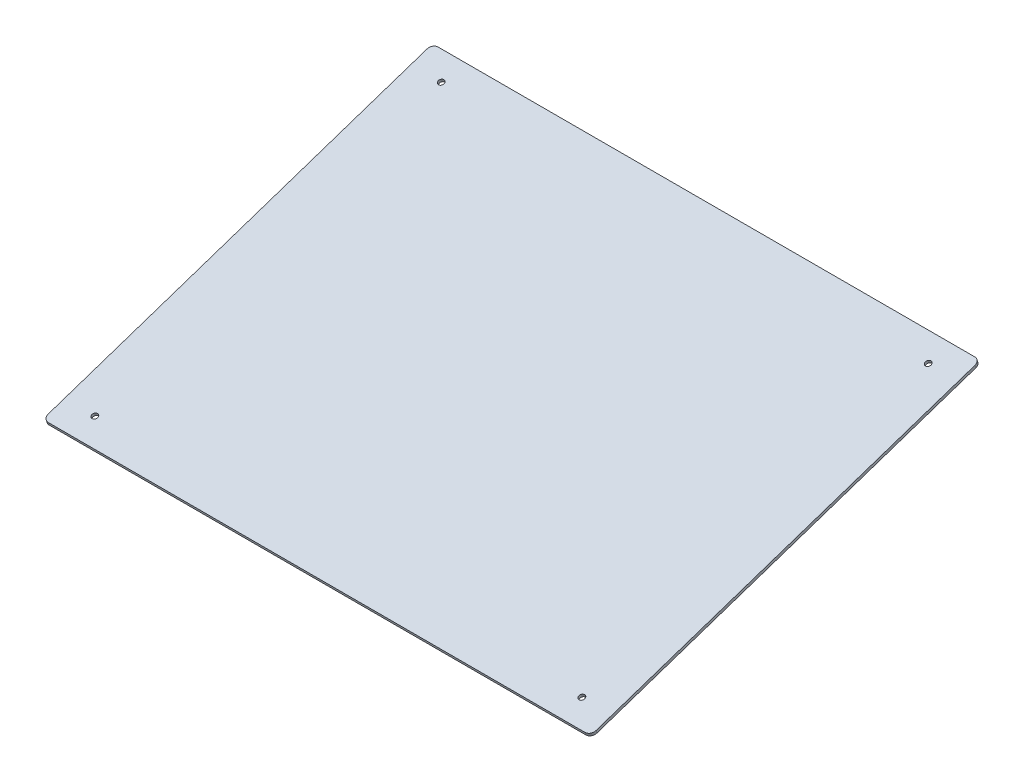
from build123d import *

# Parameters (mm, degrees)
SKETCH3_W           = 457.2
SKETCH3_H           = 609.6
SKETCH3_R           = 3.175
BOSS_EXTRUDE1_DEPTH = 3.175
FILLET1_R           = 6.35


with BuildPart() as part:
    # Sketch3 → Boss-Extrude1 (new body)
    with BuildSketch(Plane(origin=(0, 0, 0), x_dir=(0, 0.3173046564050865, -0.9483236552062013), z_dir=(0, -0.9483236552062012, -0.3173046564050864))):
        Rectangle(SKETCH3_W, SKETCH3_H)
        with Locations((203.2, -270.933333333)):
            Circle(SKETCH3_R, mode=Mode.SUBTRACT)
        with Locations((-203.2, -270.933333333)):
            Circle(SKETCH3_R, mode=Mode.SUBTRACT)
        with Locations((-203.2, 270.933333333)):
            Circle(SKETCH3_R, mode=Mode.SUBTRACT)
        with Locations((203.2, 270.933333333)):
            Circle(SKETCH3_R, mode=Mode.SUBTRACT)
    extrude(amount=-BOSS_EXTRUDE1_DEPTH)

    # Fillet1
    fillet1_edges = [part.edges().sort_by_distance(p)[0] for p in [
        (-304.8, -71.030380652, 217.290508722),
        (-304.8, 74.041308257, -216.283066438),
        (304.8, 74.041308257, -216.283066438),
        (304.8, -71.030380652, 217.290508722),
    ]]
    fillet(fillet1_edges, radius=FILLET1_R)


solid = part.part
